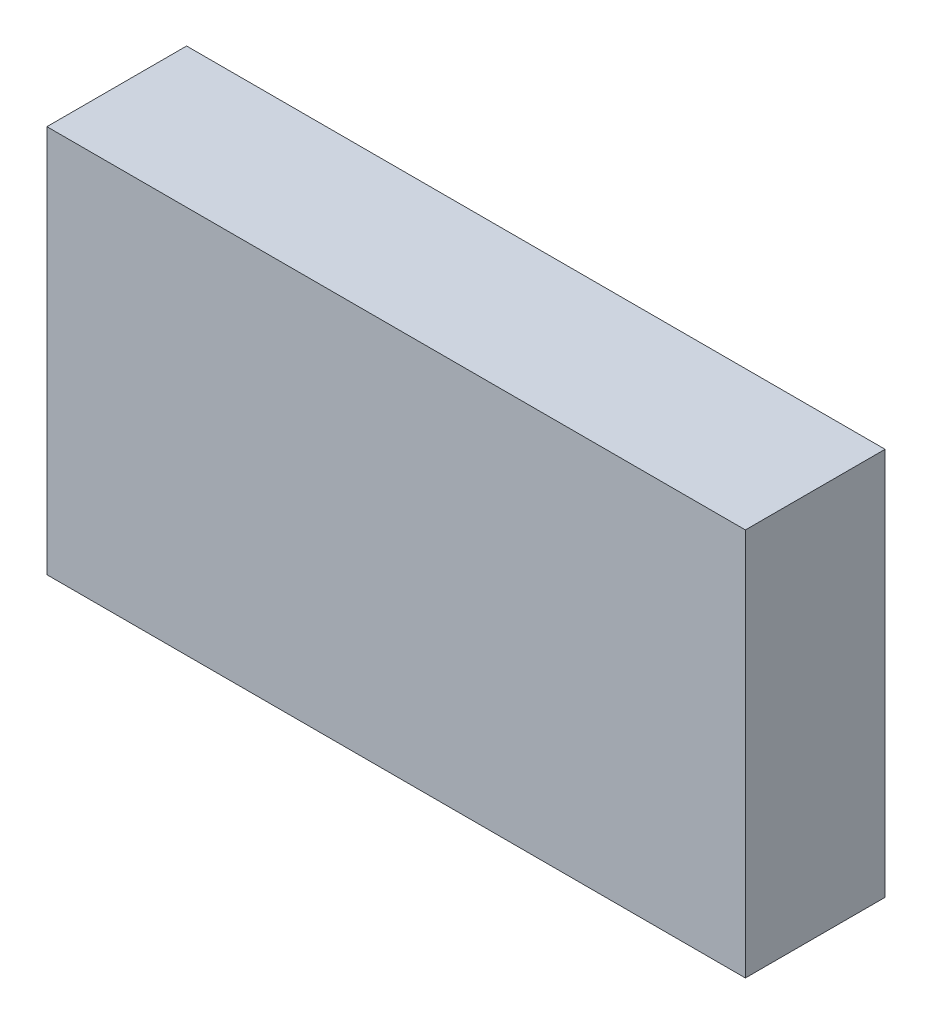
from build123d import *

# Parameters (mm, degrees)
ESQUISSE1_W        = 90
ESQUISSE1_H        = 50
BOSS_EXTRU_1_DEPTH = 18


with BuildPart() as part:
    # Esquisse1 → Boss.-Extru.1 (new body)
    with BuildSketch(Plane.XY):
        with Locations((45, 25)):
            Rectangle(ESQUISSE1_W, ESQUISSE1_H)
    extrude(amount=BOSS_EXTRU_1_DEPTH)


solid = part.part
